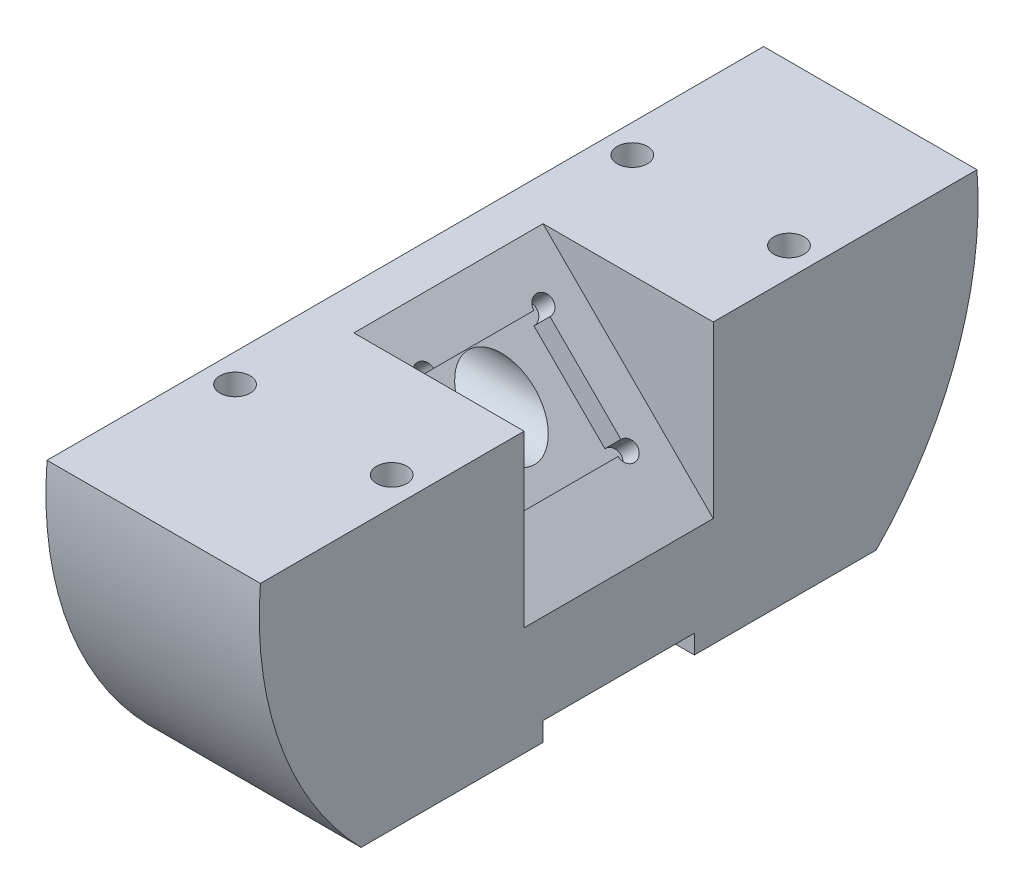
from build123d import *

# Parameters (mm, degrees)
SKETCH_1_R                = 19
EXTRUDE_1_DEPTH           = 40
CUT_EXTRUDE_1_DEPTH       = 49.187135213
CUT_EXTRUDE_1_DEPTH_BACK  = 49.187135213
SKETCH_2_OUTSIDE_W        = 55.398
SKETCH_2_OUTSIDE_H        = 53.398
SKETCH_3_R                = 1.75
CUT_EXTRUDE_2_DEPTH       = 7.4
CUT_EXTRUDE_4_DEPTH       = 5
SKETCH_6_W                = 6.3
SKETCH_6_H                = 6.3
CUT_EXTRUDE_5_DEPTH       = 1.2
SKETCH_10_R               = 1.4
CUT_EXTRUDE_8_DEPTH       = 13.7
CUT_EXTRUDE_9_REACH       = 35.156
SKETCH_11_R               = 0.8
SKETCH_12_W               = 8
SKETCH_12_H               = 2.5
CUT_EXTRUDE_10_DEPTH      = 27.566913633
SKETCH_13_R               = 0.5
CUT_EXTRUDE_11_DEPTH      = 1.2
CUT_EXTRUDE_12_DEPTH      = 27.566913633
CUT_EXTRUDE_12_DEPTH_BACK = 27.566913633
SKETCH_14_W               = 31.188232258
SKETCH_14_H               = 3.19353307


with BuildPart() as part:
    # 草图1 → 凸台-拉伸1 (new body)
    with BuildSketch(Plane(origin=(0, 0, 0), x_dir=(0, 0, -1), z_dir=(1, 0, 0))):
        Circle(SKETCH_1_R)
    extrude(amount=EXTRUDE_1_DEPTH)

    # 草图2 outside → 切除-拉伸1 (cut, two sides: drawn at the far end of the back side and taken through both)
    with BuildSketch(Plane.XY.offset(-CUT_EXTRUDE_1_DEPTH_BACK)):
        with Locations((20, 0)):
            Rectangle(SKETCH_2_OUTSIDE_W, SKETCH_2_OUTSIDE_H)
        Polygon((12.186055083, 1.5), (14.466055083, 1.5), (23.466055083, 1.5), (23.466055083, -7.5), (23.466055083, -14.75), (12.186055083, -14.75), align=None, mode=Mode.SUBTRACT)
    extrude(amount=CUT_EXTRUDE_1_DEPTH + CUT_EXTRUDE_1_DEPTH_BACK, mode=Mode.SUBTRACT)

    # 草图3 → 切除-拉伸2 (cut)
    with BuildSketch(Plane.ZY.offset(-12.186055083)):
        with Locations((0, -3)):
            Circle(SKETCH_3_R)
    extrude(amount=-CUT_EXTRUDE_2_DEPTH, mode=Mode.SUBTRACT)

    # 草图5 → 切除-拉伸4 (cut, symmetric)
    with BuildSketch(Plane.XY):
        Polygon((14.466055083, 1.5), (23.466055083, -7.5), (23.466055083, 1.5), align=None)
    extrude(amount=CUT_EXTRUDE_4_DEPTH, both=True, mode=Mode.SUBTRACT)

    # 草图6 → 切除-拉伸5 (cut)
    with BuildSketch(Plane(origin=(7.983027542, 7.983027542, 0), x_dir=(0, 0, -1), z_dir=(0.7071067811865487, 0.7071067811865465, 0))):
        with Locations((0, -14.958385475)):
            Rectangle(SKETCH_6_W, SKETCH_6_H)
    extrude(amount=-CUT_EXTRUDE_5_DEPTH, mode=Mode.SUBTRACT)

    # 草图10 → 切除-拉伸8 (cut)
    with BuildSketch(Plane.XZ.offset(14.75)):
        with Locations((13.686055083, 10.5)):
            Circle(SKETCH_10_R)
        with Locations((21.966055083, 10.5)):
            Circle(SKETCH_10_R)
        with Locations((13.686055083, -10.5)):
            Circle(SKETCH_10_R)
        with Locations((21.966055083, -10.5)):
            Circle(SKETCH_10_R)
    extrude(amount=-CUT_EXTRUDE_8_DEPTH, mode=Mode.SUBTRACT)

    # 草图11 → 切除-拉伸9 (cut, up to next)
    with BuildSketch(Plane.XZ.offset(1.05), mode=Mode.PRIVATE) as cut_extrude_9_sk1:
        with Locations((13.686055083, 10.5)):
            Circle(SKETCH_11_R)
    cut_extrude_9_tool1 = extrude(cut_extrude_9_sk1.sketch, amount=-CUT_EXTRUDE_9_REACH, mode=Mode.PRIVATE) & part.part
    # 草图11 → 切除-拉伸9 (cut, up to next)
    with BuildSketch(Plane.XZ.offset(1.05), mode=Mode.PRIVATE) as cut_extrude_9_sk2:
        with Locations((21.966055083, 10.5)):
            Circle(SKETCH_11_R)
    cut_extrude_9_tool2 = extrude(cut_extrude_9_sk2.sketch, amount=-CUT_EXTRUDE_9_REACH, mode=Mode.PRIVATE) & part.part
    # 草图11 → 切除-拉伸9 (cut, up to next)
    with BuildSketch(Plane.XZ.offset(1.05), mode=Mode.PRIVATE) as cut_extrude_9_sk3:
        with Locations((13.686055083, -10.5)):
            Circle(SKETCH_11_R)
    cut_extrude_9_tool3 = extrude(cut_extrude_9_sk3.sketch, amount=-CUT_EXTRUDE_9_REACH, mode=Mode.PRIVATE) & part.part
    # 草图11 → 切除-拉伸9 (cut, up to next)
    with BuildSketch(Plane.XZ.offset(1.05), mode=Mode.PRIVATE) as cut_extrude_9_sk4:
        with Locations((21.966055083, -10.5)):
            Circle(SKETCH_11_R)
    cut_extrude_9_tool4 = extrude(cut_extrude_9_sk4.sketch, amount=-CUT_EXTRUDE_9_REACH, mode=Mode.PRIVATE) & part.part
    add(cut_extrude_9_tool1.solids().sort_by_distance((13.686055, -1.05, 10.5))[0], mode=Mode.SUBTRACT)
    add(cut_extrude_9_tool2.solids().sort_by_distance((21.966055, -1.05, 10.5))[0], mode=Mode.SUBTRACT)
    add(cut_extrude_9_tool3.solids().sort_by_distance((13.686055, -1.05, -10.5))[0], mode=Mode.SUBTRACT)
    add(cut_extrude_9_tool4.solids().sort_by_distance((21.966055, -1.05, -10.5))[0], mode=Mode.SUBTRACT)

    # 草图12 → 切除-拉伸10 (cut, through all)
    with BuildSketch(Plane(origin=(23.466055083, 0, 0), x_dir=(0, 0, -1), z_dir=(1, 0, 0))):
        with Locations((0, -13.5)):
            Rectangle(SKETCH_12_W, SKETCH_12_H)
    extrude(amount=-CUT_EXTRUDE_10_DEPTH, mode=Mode.SUBTRACT)

    # 草图13 → 切除-拉伸11 (cut)
    with BuildSketch(Plane(origin=(7.983027542, 7.983027542, 0), x_dir=(0, 0, -1), z_dir=(0.7071067811865487, 0.7071067811865465, 0))):
        with Locations((-3.15, -11.808385475)):
            Circle(SKETCH_13_R)
        with Locations((3.15, -11.808385475)):
            Circle(SKETCH_13_R)
        with Locations((-3.15, -18.108385475)):
            Circle(SKETCH_13_R)
        with Locations((3.15, -18.108385475)):
            Circle(SKETCH_13_R)
    extrude(amount=-CUT_EXTRUDE_11_DEPTH, mode=Mode.SUBTRACT)

    # 草图14 → 切除-拉伸12 (cut, two sides: drawn at the far end of the back side and taken through both)
    with BuildSketch(Plane.ZY.offset(-12.186055083).offset(-CUT_EXTRUDE_12_DEPTH_BACK)):
        with Locations((-0.125755843, -14.846766535)):
            Rectangle(SKETCH_14_W, SKETCH_14_H)
    extrude(amount=CUT_EXTRUDE_12_DEPTH + CUT_EXTRUDE_12_DEPTH_BACK, mode=Mode.SUBTRACT)


solid = part.part
